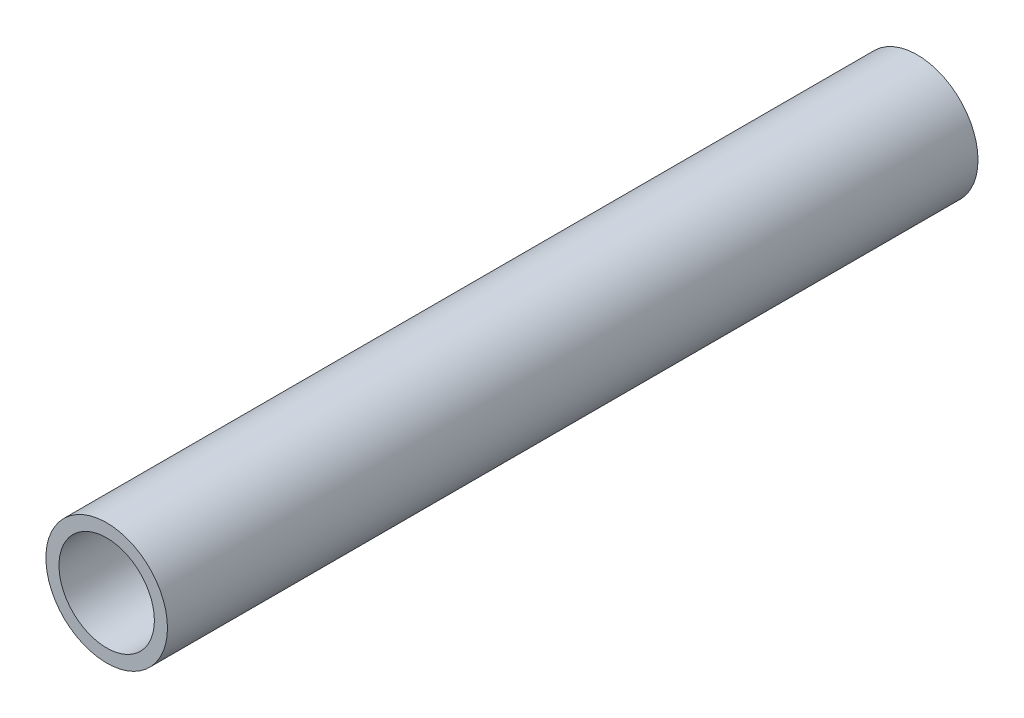
from build123d import *

# Parameters (mm, degrees)
SKETCH1_R           = 13.335
SKETCH1_R_2         = 10.4648
BOSS_EXTRUDE1_DEPTH = 177.8


with BuildPart() as part:
    # Sketch1 → Boss-Extrude1 (new body)
    with BuildSketch(Plane.XY):
        Circle(SKETCH1_R)
        Circle(SKETCH1_R_2, mode=Mode.SUBTRACT)
    extrude(amount=BOSS_EXTRUDE1_DEPTH)


solid = part.part
